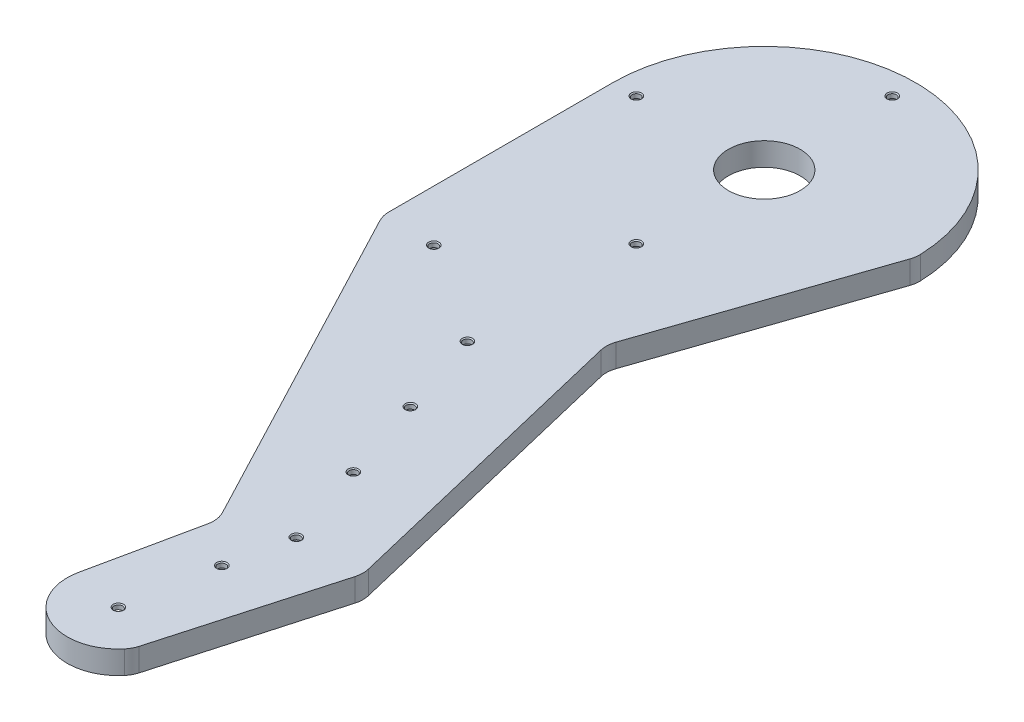
from build123d import *

# Parameters (mm, degrees)
EXTRUDE_1_DEPTH              = 5
FILLET_1_R                   = 10
EXTRUDE_START                = 2
EXTRUDE_2_DEPTH              = 2
CUT_EXTRUDE_2_DEPTH          = 198.453534081
CUT_EXTRUDE_2_DEPTH_BACK     = 198.453534081
SKETCH_7_R                   = 5
CUT_EXTRUDE_4_DEPTH          = 198.514298523
CUT_EXTRUDE_4_DEPTH_BACK     = 7
SKETCH_5_R                   = 14
SKETCH_9_R                   = 14
CUT_EXTRUDE_5_DEPTH          = 10
CUT_EXTRUDE_7_DEPTH          = 10
CUT_EXTRUDE_7_DEPTH_BACK     = 10
SKETCH_6_R                   = 5
SKETCH_10_R                  = 14
EXTRUDE_3_DEPTH              = 2
HOLE_WIZARD_M4_1_AT_2_COUNT  = 2
HOLE_WIZARD_M4_1_AT_2_PITCH  = 100
HOLE_WIZARD_M4_1_AT_3_COUNT  = 2
HOLE_WIZARD_M4_1_AT_3_PITCH  = 70.710678119
HOLE_WIZARD_M4_1_AT_4_COUNT  = 2
HOLE_WIZARD_M4_1_AT_4_PITCH  = 145.35973122
HOLE_WIZARD_M4_1_AT_5_COUNT  = 2
HOLE_WIZARD_M4_1_AT_5_PITCH  = 165.991285367
HOLE_WIZARD_M4_1_AT_6_COUNT  = 2
HOLE_WIZARD_M4_1_AT_6_PITCH  = 199.531595345
HOLE_WIZARD_M4_1_AT_7_COUNT  = 2
HOLE_WIZARD_M4_1_AT_7_PITCH  = 233.500767159
HOLE_WIZARD_M4_1_AT_8_COUNT  = 2
HOLE_WIZARD_M4_1_AT_8_PITCH  = 267.735613968
HOLE_WIZARD_M4_1_AT_9_COUNT  = 2
HOLE_WIZARD_M4_1_AT_9_PITCH  = 291.147962879
HOLE_WIZARD_M4_2_D           = 3.3
HOLE_WIZARD_M4_2_DEPTH       = 10.1
HOLE_WIZARD_M4_2_CSINK_D     = 4.05
HOLE_WIZARD_M4_2_CSINK_ANGLE = 90
HOLE_WIZARD_M4_2_TIP         = 0.991420021


with BuildPart() as part:
    # 草图1 → 凸台-拉伸1 (new body)
    with BuildSketch(Plane(origin=(0, 0, 0), x_dir=(1, 0, 0), z_dir=(0, 1, 0))):
        with BuildLine():
            Line((28.36210367, 15.823673932), (59.117479337, 105.823673932))
            ThreePointArc((59.117479337, 105.823673932), (0, 164.941153269), (-59.117479337, 105.823673932))
            Line((-59.117479337, 105.823673932), (-59.117478081, 105.811488283))
            Line((-59.117478081, 105.811488283), (-59.108203667, 15.82367441))
            Line((-59.108203667, 15.82367441), (11.786941507, -119.17632559))
            Line((11.786941507, -119.17632559), (2.233923801, -164.17632559))
            ThreePointArc((2.233923801, -164.17632559), (14.171961552, -186.818592843), (38.601140216, -179.176326068))
            Line((38.601140216, -179.176326068), (58.357719046, -109.176326068))
            Line((58.357719046, -109.176326068), (28.36210367, 15.823673932))
        make_face()
    extrude(amount=EXTRUDE_1_DEPTH)

    # 圆角1
    fillet_1_edges = [part.edges().sort_by_distance(p)[0] for p in [
        (11.786941507, 2.5, 119.17632559),
        (-59.108203667, 2.5, -15.82367441),
        (59.117479337, 2.5, -105.823673932),
        (28.36210367, 2.5, -15.823673932),
        (58.357719046, 2.5, 109.176326068),
        (38.601140216, 2.5, 179.176326068),
    ]]
    fillet(fillet_1_edges, radius=FILLET_1_R)

    # 草图8 → 凸台-拉伸2 (add)
    with BuildSketch(Plane(origin=(0, 5, 0), x_dir=(1, 0, 0), z_dir=(0, 1, 0)).offset(EXTRUDE_START)):
        with BuildLine():
            Line((29.300361737, 18.569315114), (58.554588826, 104.176477469))
            ThreePointArc((58.554588826, 104.176477469), (58.98180751, 105.930695077), (59.086633883, 107.733139709))
            ThreePointArc((59.086633883, 107.733139709), (-0.95485745, 164.933441402), (-59.117479337, 105.823673932))
            Line((-59.117479337, 105.823673932), (-59.108457771, 18.289190078))
            ThreePointArc((-59.108457771, 18.289190078), (-58.817462925, 15.895388783), (-57.961893059, 13.640846069))
            Line((-57.961893059, 13.640846069), (10.108867752, -115.980902881))
            ThreePointArc((10.108867752, -115.980902881), (11.161474402, -119.262675904), (11.037439917, -122.706892851))
            Line((11.037439917, -122.706892851), (2.233923801, -164.17632559))
            ThreePointArc((2.233923801, -164.17632559), (13.031285464, -186.305812614), (37.116640576, -181.187914225))
            ThreePointArc((37.116640576, -181.187914225), (38.296139318, -179.43577869), (39.081319631, -177.47499107))
            Line((39.081319631, -177.47499107), (57.648798745, -111.688118295))
            ThreePointArc((57.648798745, -111.688118295), (58.022811544, -109.169699075), (57.748719119, -106.63845545))
            Line((57.748719119, -106.63845545), (29.039148609, 13.002240988))
            ThreePointArc((29.039148609, 13.002240988), (28.774088822, 15.804343144), (29.300361737, 18.569315114))
        make_face()
    extrude(amount=-EXTRUDE_2_DEPTH)

    # 草图7 → 切除-拉伸2 (cut, two sides: drawn at the far end of the back side and taken through both)
    with BuildSketch(Plane(origin=(0, 5, 0), x_dir=(1, 0, 0), z_dir=(0, 1, 0)).offset(-CUT_EXTRUDE_2_DEPTH_BACK)):
        with Locations(Location((0, -10.167611435, 0), (0, 0, 270))):
            Circle(SKETCH_7_R)
        with Locations(Location((10.962320581, -43.406557379, 0), (0, 0, 270))):
            Circle(SKETCH_7_R)
        with Locations(Location((21.924641163, -76.645503323, 0), (0, 0, 270))):
            Circle(SKETCH_7_R)
        with Locations(Location((32.886961744, -109.884449267, 0), (0, 0, 270))):
            Circle(SKETCH_7_R)
        with Locations(Location((27.862861404, -133.987984293, 0), (0, 0, 270))):
            Circle(SKETCH_7_R)
    extrude(amount=CUT_EXTRUDE_2_DEPTH + CUT_EXTRUDE_2_DEPTH_BACK, mode=Mode.SUBTRACT)

    # 草图5 → 切除-拉伸4 (cut, two sides: drawn at the far end of the back side and taken through both)
    with BuildSketch(Plane(origin=(0, 0, 0), x_dir=(-1, 0, 0), z_dir=(0, -1, 0)).offset(-CUT_EXTRUDE_4_DEPTH_BACK)):
        with Locations(Location((-21.7979386, -168.329556252, 0), (0, 0, 270))):
            Circle(SKETCH_5_R)
    extrude(amount=CUT_EXTRUDE_4_DEPTH + CUT_EXTRUDE_4_DEPTH_BACK, mode=Mode.SUBTRACT)

    # 草图9 → 切除-拉伸5 (cut)
    with BuildSketch(Plane(origin=(0, 7, 0), x_dir=(1, 0, 0), z_dir=(0, 1, 0))):
        with Locations(Location((0, 105.823673932, 0), (0, 0, 270))):
            Circle(SKETCH_9_R)
    extrude(amount=-CUT_EXTRUDE_5_DEPTH, mode=Mode.SUBTRACT)

    # 草图6 → 切除-拉伸7 (cut, two sides: drawn at the far end of the back side and taken through both)
    with BuildSketch(Plane(origin=(0, 5, 0), x_dir=(1, 0, 0), z_dir=(0, 1, 0)).offset(-CUT_EXTRUDE_7_DEPTH_BACK)):
        with Locations(Location((0, 155.823673932, 0), (0, 0, 270))):
            Circle(SKETCH_6_R)
        with Locations(Location((0, 55.823673932, 0), (0, 0, 270))):
            Circle(SKETCH_6_R)
        with Locations(Location((-50, 105.823673932, 0), (0, 0, 270))):
            Circle(SKETCH_6_R)
        with Locations(Location((-39.108203667, 15.82367441, 0), (0, 0, 270))):
            Circle(SKETCH_6_R)
    extrude(amount=CUT_EXTRUDE_7_DEPTH + CUT_EXTRUDE_7_DEPTH_BACK, mode=Mode.SUBTRACT)

    # 草图10 → 凸台-拉伸3 (add)
    with BuildSketch(Plane(origin=(0, 7, 0), x_dir=(1, 0, 0), z_dir=(0, 1, 0)).offset(EXTRUDE_START)):
        with BuildLine():
            Line((29.300361737, 18.569315114), (58.554588826, 104.176477469))
            ThreePointArc((58.554588826, 104.176477469), (58.98180751, 105.930695077), (59.086633883, 107.733139709))
            ThreePointArc((59.086633883, 107.733139709), (-0.95485745, 164.933441402), (-59.117479337, 105.823673932))
            Line((-59.117479337, 105.823673932), (-59.108457771, 18.289190078))
            ThreePointArc((-59.108457771, 18.289190078), (-58.817462925, 15.895388783), (-57.961893059, 13.640846069))
            Line((-57.961893059, 13.640846069), (10.108867752, -115.980902881))
            ThreePointArc((10.108867752, -115.980902881), (11.161474402, -119.262675904), (11.037439917, -122.706892851))
            Line((11.037439917, -122.706892851), (2.233923801, -164.17632559))
            ThreePointArc((2.233923801, -164.17632559), (13.031285464, -186.305812614), (37.116640576, -181.187914225))
            ThreePointArc((37.116640576, -181.187914225), (38.296139318, -179.43577869), (39.081319631, -177.47499107))
            Line((39.081319631, -177.47499107), (57.648798745, -111.688118295))
            ThreePointArc((57.648798745, -111.688118295), (58.022811544, -109.169699075), (57.748719119, -106.63845545))
            Line((57.748719119, -106.63845545), (29.039148609, 13.002240988))
            ThreePointArc((29.039148609, 13.002240988), (28.774088822, 15.804343144), (29.300361737, 18.569315114))
        make_face()
        with Locations(Location((0, 105.823673932, 0), (0, 0, 270))):
            Circle(SKETCH_10_R, mode=Mode.SUBTRACT)
    extrude(amount=-EXTRUDE_3_DEPTH)

    # 草图13 → M4 螺纹孔1 (revolve, cut)
    with BuildSketch(Plane(origin=(0, 9, -155.823673932), x_dir=(0, 0, 1), z_dir=(1, 0, 0))):
        Polygon((0, 0), (0, 2), (1.65, 2), (1.65, 0.375), (2.025, 0), align=None)
    hole_wizard_m4_1 = revolve(axis=Axis((0, 15.35, -155.823673932), (0, -1, 0)), mode=Mode.SUBTRACT)

    # M4 螺纹孔1 at 2: M4 螺纹孔1 ×2
    with Locations(*[(0, 0, i * HOLE_WIZARD_M4_1_AT_2_PITCH) for i in range(1, HOLE_WIZARD_M4_1_AT_2_COUNT)]):
        add(hole_wizard_m4_1, mode=Mode.SUBTRACT)

    # M4 螺纹孔1 at 3: M4 螺纹孔1 ×2
    with Locations(*[Vector(-0.7071067811865475, 0, 0.7071067811865476) * (i * HOLE_WIZARD_M4_1_AT_3_PITCH) for i in range(1, HOLE_WIZARD_M4_1_AT_3_COUNT)]):
        add(hole_wizard_m4_1, mode=Mode.SUBTRACT)

    # M4 螺纹孔1 at 4: M4 螺纹孔1 ×2
    with Locations(*[Vector(-0.2690442761497492, 0, 0.9631278095201371) * (i * HOLE_WIZARD_M4_1_AT_4_PITCH) for i in range(1, HOLE_WIZARD_M4_1_AT_4_COUNT)]):
        add(hole_wizard_m4_1, mode=Mode.SUBTRACT)

    # M4 螺纹孔1 at 5: M4 螺纹孔1 ×2
    with Locations(*[(0, 0, i * HOLE_WIZARD_M4_1_AT_5_PITCH) for i in range(1, HOLE_WIZARD_M4_1_AT_5_COUNT)]):
        add(hole_wizard_m4_1, mode=Mode.SUBTRACT)

    # M4 螺纹孔1 at 6: M4 螺纹孔1 ×2
    with Locations(*[Vector(0.05494027430843455, 0, 0.998489642539628) * (i * HOLE_WIZARD_M4_1_AT_6_PITCH) for i in range(1, HOLE_WIZARD_M4_1_AT_6_COUNT)]):
        add(hole_wizard_m4_1, mode=Mode.SUBTRACT)

    # M4 螺纹孔1 at 7: M4 螺纹孔1 ×2
    with Locations(*[Vector(0.09389537100730377, 0, 0.9955820706016159) * (i * HOLE_WIZARD_M4_1_AT_7_PITCH) for i in range(1, HOLE_WIZARD_M4_1_AT_7_COUNT)]):
        add(hole_wizard_m4_1, mode=Mode.SUBTRACT)

    # M4 螺纹孔1 at 8: M4 螺纹孔1 ×2
    with Locations(*[Vector(0.12283372113599639, 0, 0.9924272653206805) * (i * HOLE_WIZARD_M4_1_AT_8_PITCH) for i in range(1, HOLE_WIZARD_M4_1_AT_8_COUNT)]):
        add(hole_wizard_m4_1, mode=Mode.SUBTRACT)

    # M4 螺纹孔1 at 9: M4 螺纹孔1 ×2
    with Locations(*[Vector(0.09570000465954767, 0, 0.9954102215208375) * (i * HOLE_WIZARD_M4_1_AT_9_PITCH) for i in range(1, HOLE_WIZARD_M4_1_AT_9_COUNT)]):
        add(hole_wizard_m4_1, mode=Mode.SUBTRACT)

    # M4 螺纹孔2
    with Locations(Plane(origin=(0, 9, 0), x_dir=(1, 0, 0), z_dir=(0, 1, 0))):
        with Locations((21.7979386, -168.329556252)):
            CounterSinkHole(HOLE_WIZARD_M4_2_D / 2, HOLE_WIZARD_M4_2_CSINK_D / 2, depth=HOLE_WIZARD_M4_2_DEPTH, counter_sink_angle=HOLE_WIZARD_M4_2_CSINK_ANGLE)
            with Locations((0, 0, -(HOLE_WIZARD_M4_2_DEPTH + HOLE_WIZARD_M4_2_TIP / 2))):  # 118° drill point
                Cone(0, HOLE_WIZARD_M4_2_D / 2, HOLE_WIZARD_M4_2_TIP, mode=Mode.SUBTRACT)


solid = part.part
